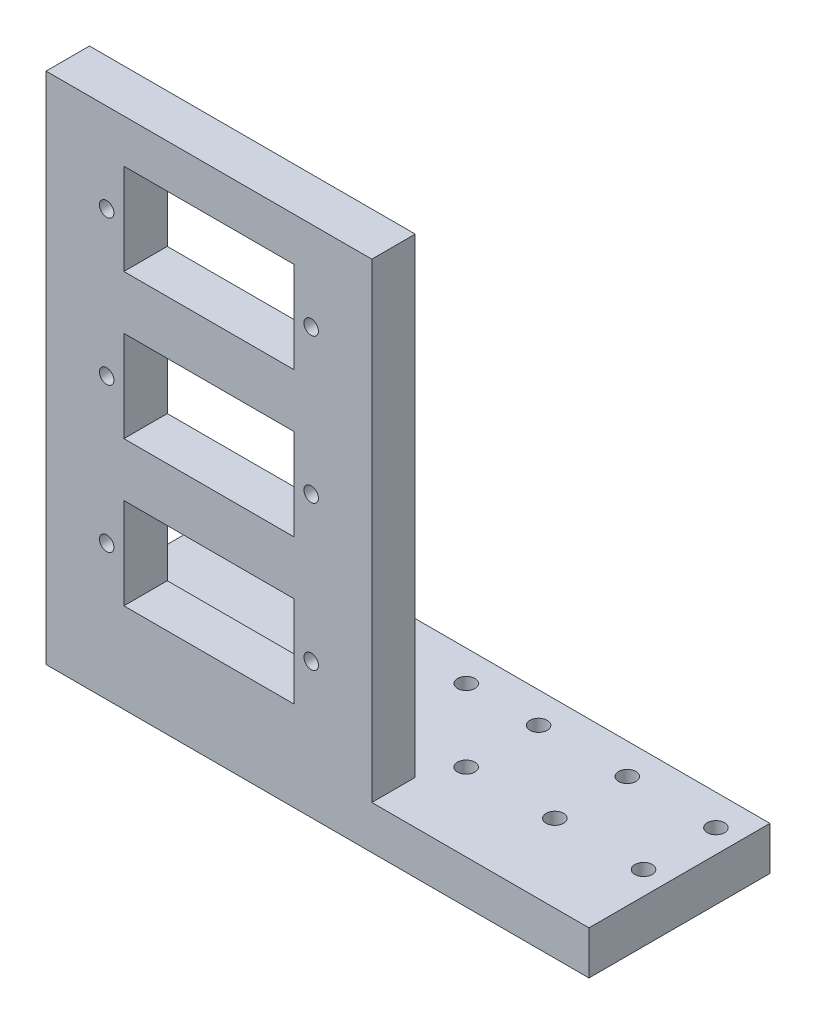
from build123d import *

# Parameters (mm, degrees)
SKETCH1_W           = 45
SKETCH1_H           = 6
BOSS_EXTRUDE1_DEPTH = 65
SKETCH2_R           = 1
SKETCH2_W           = 23.5
SKETCH2_H           = 12.6
CUT_EXTRUDE1_DEPTH  = 80.284298572
LPATTERN1_COUNT     = 3
LPATTERN1_PITCH     = 20
SKETCH3_W           = 45
SKETCH3_H           = 25
BOSS_EXTRUDE2_DEPTH = 6
SKETCH4_W           = 25
SKETCH4_H           = 6
BOSS_EXTRUDE3_DEPTH = 30
SKETCH5_R           = 1.2
CUT_EXTRUDE2_DEPTH  = 107.259117256


with BuildPart() as part:
    # Sketch1 → Boss-Extrude1 (new body)
    with BuildSketch(Plane(origin=(0, 0, 0), x_dir=(1, 0, 0), z_dir=(0, 1, 0))):
        with Locations((22.5, 3)):
            Rectangle(SKETCH1_W, SKETCH1_H)
    extrude(amount=BOSS_EXTRUDE1_DEPTH)

    # Sketch2 → Cut-Extrude1 (cut, through all)
    with BuildSketch(Plane.XY):
        with Locations((8.375, 52.7)):
            Circle(SKETCH2_R)
        with Locations((36.625, 52.7)):
            Circle(SKETCH2_R)
        with Locations((22.5, 52.7)):
            Rectangle(SKETCH2_W, SKETCH2_H)
    cut_extrude1 = extrude(amount=-CUT_EXTRUDE1_DEPTH, mode=Mode.SUBTRACT)

    # LPattern1: Cut-Extrude1 ×3
    with Locations(*[(0, -i * LPATTERN1_PITCH, 0) for i in range(1, LPATTERN1_COUNT)]):
        add(cut_extrude1, mode=Mode.SUBTRACT)

    # Sketch3 → Boss-Extrude2 (add)
    with BuildSketch(Plane.XZ):
        with Locations((22.5, -12.5)):
            Rectangle(SKETCH3_W, SKETCH3_H)
    extrude(amount=BOSS_EXTRUDE2_DEPTH)

    # Sketch4 → Boss-Extrude3 (add)
    with BuildSketch(Plane(origin=(45, 0, 0), x_dir=(0, 0, -1), z_dir=(1, 0, 0))):
        with Locations((12.5, -3)):
            Rectangle(SKETCH4_W, SKETCH4_H)
    extrude(amount=BOSS_EXTRUDE3_DEPTH)

    # Sketch5 → Cut-Extrude2 (cut, through all)
    with BuildSketch(Plane.XZ.offset(6)):
        with Locations(Location((37.288839919, -20.74934001, 0), (0, 0, 270))):
            Circle(SKETCH5_R)
        with Locations(Location((37.288839919, -10.74934001, 0), (0, 0, 270))):
            Circle(SKETCH5_R)
        with Locations(Location((47.288839919, -20.74934001, 0), (0, 0, 270))):
            Circle(SKETCH5_R)
        with Locations(Location((47.288839919, -10.74934001, 0), (0, 0, 270))):
            Circle(SKETCH5_R)
        with Locations(Location((59.538839919, -20.74934001, 0), (0, 0, 270))):
            Circle(SKETCH5_R)
        with Locations(Location((71.788839919, -20.74934001, 0), (0, 0, 270))):
            Circle(SKETCH5_R)
        with Locations(Location((71.788839919, -10.74934001, 0), (0, 0, 270))):
            Circle(SKETCH5_R)
        with Locations(Location((59.538839919, -10.74934001, 0), (0, 0, 270))):
            Circle(SKETCH5_R)
    extrude(amount=-CUT_EXTRUDE2_DEPTH, mode=Mode.SUBTRACT)


solid = part.part
